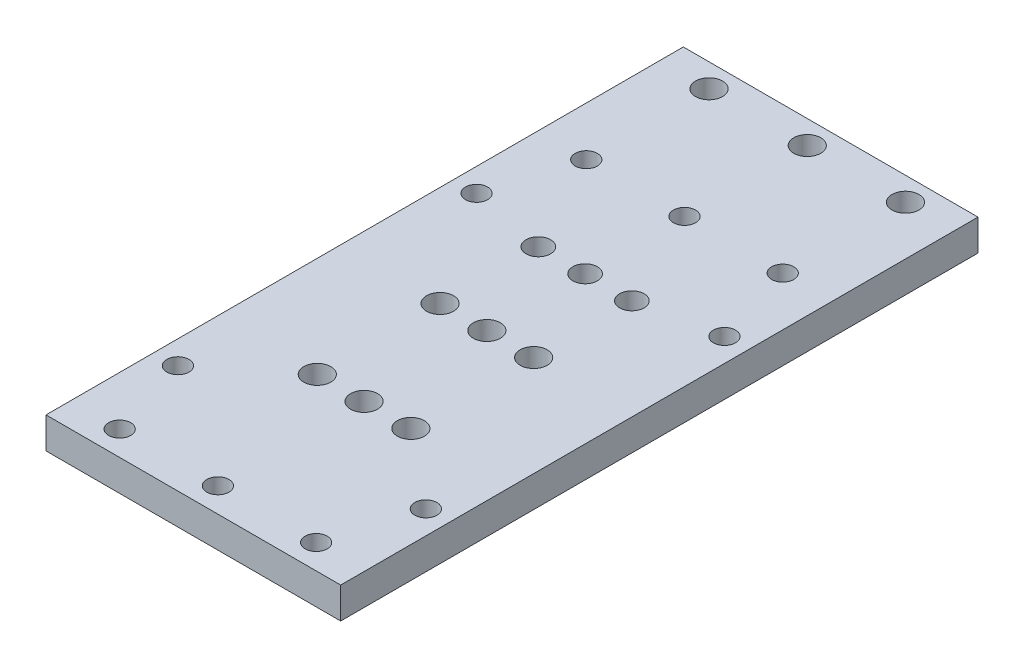
from build123d import *

# Parameters (mm, degrees)
SKETCH1_W               = 60
SKETCH1_H               = 160
BOSS_EXTRUDE1_DEPTH     = 3.175
M4_5_THROUGH_DEPTH      = 6.35
M4_5_THROUGH_DEPTH_BACK = 3.175
SKETCH3_R               = 2.75
SKETCH3_R_2             = 2.25
SKETCH4_R               = 1.5
M3_DRILL_DEPTH          = 8
SKETCH5_R               = 2.25
M4_THROUGH_DEPTH        = 6.35
SKETCH6_R               = 2.5
M5_DRILL_DEPTH          = 6.35
SKETCH7_R               = 2.75
M5_THROUGH_DEPTH        = 6.35
SKETCH8_W               = 60
SKETCH8_H               = 30.2375
CUT_EXTRUDE3_DEPTH      = 6.35


with BuildPart() as part:
    # Sketch1 → Boss-Extrude1 (new, symmetric)
    with BuildSketch(Plane(origin=(0, 0, 0), x_dir=(1, 0, 0), z_dir=(0, 1, 0))):
        Rectangle(SKETCH1_W, SKETCH1_H)
    extrude(amount=BOSS_EXTRUDE1_DEPTH, both=True)

    # Sketch3 → M4/5_through (cut, two sides: drawn at the far end of the back side and taken through both)
    with BuildSketch(Plane(origin=(0, 0, 0), x_dir=(1, 0, 0), z_dir=(0, 1, 0)).offset(-M4_5_THROUGH_DEPTH_BACK)):
        with Locations(Location((20, 75.2375, 0), (0, 0, 270))):
            Circle(SKETCH3_R)
        with Locations(Location((20, 50.2375, 0), (0, 0, 270))):
            Circle(SKETCH3_R_2)
        with Locations(Location((-20, 50.2375, 0), (0, 0, 270))):
            Circle(SKETCH3_R_2)
        with Locations(Location((-20, 75.2375, 0), (0, 0, 270))):
            Circle(SKETCH3_R)
        with Locations(Location((0, 75.2375, 0), (0, 0, 270))):
            Circle(SKETCH3_R)
        with Locations(Location((0, 50.2375, 0), (0, 0, 270))):
            Circle(SKETCH3_R_2)
        with Locations(Location((20, -44.7625, 0), (0, 0, 270))):
            Circle(SKETCH3_R_2)
        with Locations(Location((-20, -44.7625, 0), (0, 0, 270))):
            Circle(SKETCH3_R_2)
        with Locations(Location((0, -44.7625, 0), (0, 0, 270))):
            Circle(SKETCH3_R_2)
    extrude(amount=M4_5_THROUGH_DEPTH + M4_5_THROUGH_DEPTH_BACK, mode=Mode.SUBTRACT)

    # Sketch4 → M3_DRILL (cut)
    with BuildSketch(Plane(origin=(0, 0, -80), x_dir=(-1, 0, 0), z_dir=(0, 0, -1))):
        with Locations((-12, 0)):
            Circle(SKETCH4_R)
        with Locations(Location((12, 0, 0), (0, 0, 180))):
            Circle(SKETCH4_R)
    extrude(amount=-M3_DRILL_DEPTH, mode=Mode.SUBTRACT)

    # Sketch5 → M4_through (cut)
    with BuildSketch(Plane(origin=(0, 3.175, 0), x_dir=(1, 0, 0), z_dir=(0, 1, 0))):
        with Locations(Location((-25.2375, -27.6625, 0), (0, 0, 270))):
            Circle(SKETCH5_R)
        with Locations(Location((25.2375, -27.6625, 0), (0, 0, 270))):
            Circle(SKETCH5_R)
        with Locations(Location((25.2375, 33.1375, 0), (0, 0, 270))):
            Circle(SKETCH5_R)
        with Locations(Location((-25.2375, 33.1375, 0), (0, 0, 270))):
            Circle(SKETCH5_R)
    extrude(amount=-M4_THROUGH_DEPTH, mode=Mode.SUBTRACT)

    # Sketch6 → M5_DRILL (cut)
    with BuildSketch(Plane(origin=(0, 3.175, 0), x_dir=(1, 0, 0), z_dir=(0, 1, 0))):
        with Locations(Location((0, 30, 0), (0, 0, 270))):
            Circle(SKETCH6_R)
        with Locations(Location((9.53, 30, 0), (0, 0, 270))):
            Circle(SKETCH6_R)
        with Locations(Location((-9.53, 30, 0), (0, 0, 270))):
            Circle(SKETCH6_R)
    extrude(amount=-M5_DRILL_DEPTH, mode=Mode.SUBTRACT)

    # Sketch7 → M5_through (cut)
    with BuildSketch(Plane(origin=(0, 3.175, 0), x_dir=(1, 0, 0), z_dir=(0, 1, 0))):
        with Locations(Location((0, 10, 0), (0, 0, 270))):
            Circle(SKETCH7_R)
        with Locations(Location((0, -15, 0), (0, 0, 270))):
            Circle(SKETCH7_R)
        with Locations(Location((9.53, 10, 0), (0, 0, 270))):
            Circle(SKETCH7_R)
        with Locations(Location((9.53, -15, 0), (0, 0, 270))):
            Circle(SKETCH7_R)
        with Locations(Location((-9.53, 10, 0), (0, 0, 270))):
            Circle(SKETCH7_R)
        with Locations(Location((-9.53, -15, 0), (0, 0, 270))):
            Circle(SKETCH7_R)
    extrude(amount=-M5_THROUGH_DEPTH, mode=Mode.SUBTRACT)

    # Sketch8 → Cut-Extrude3 (cut)
    with BuildSketch(Plane(origin=(0, 3.175, 0), x_dir=(1, 0, 0), z_dir=(0, 1, 0))):
        with Locations((0, -64.88125)):
            Rectangle(SKETCH8_W, SKETCH8_H)
    extrude(amount=-CUT_EXTRUDE3_DEPTH, mode=Mode.SUBTRACT)


solid = part.part
